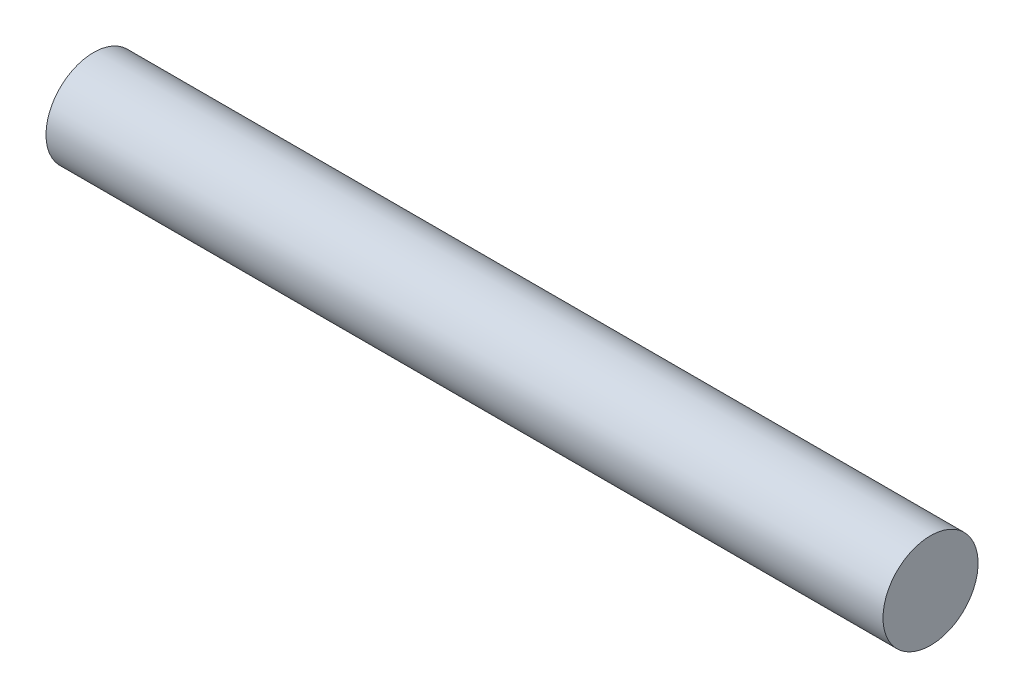
from build123d import *

# Parameters (mm, degrees)
SKETCH1_R           = 2.5
BOSS_EXTRUDE1_DEPTH = 44


with BuildPart() as part:
    # Sketch1 → Boss-Extrude1 (new body)
    with BuildSketch(Plane(origin=(0, 0, 0), x_dir=(0, 0, -1), z_dir=(1, 0, 0))):
        with Locations(Location((0, 0, 0), (0, 0, 180))):
            Circle(SKETCH1_R)
    extrude(amount=BOSS_EXTRUDE1_DEPTH)


solid = part.part
